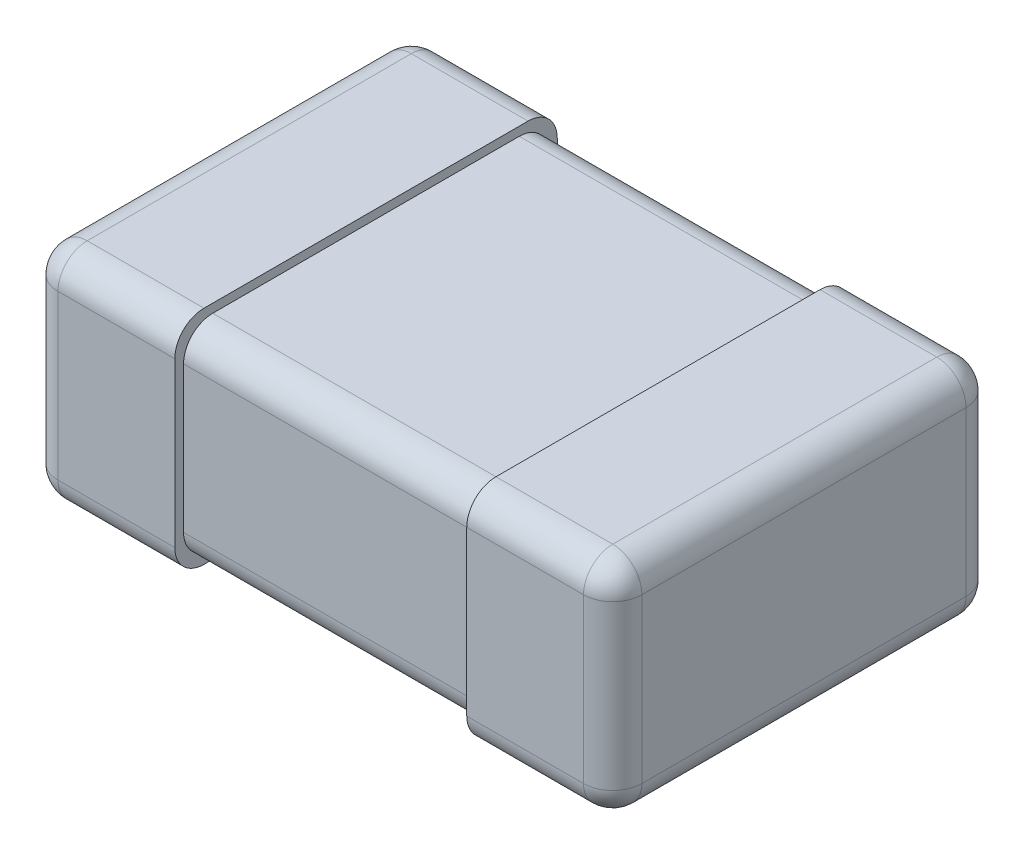
from build123d import *

# Parameters (mm, degrees)
SKETCH1_W           = 2
SKETCH1_H           = 1.25
EXTRUDE1_DEPTH      = 0.7
EXTRUDE2_DEPTH      = 0.655
EXTRUDE2_DEPTH_BACK = 0.655
SKETCH2_W           = 0.5
SKETCH2_H           = 0.76
FILLET1_R           = 0.1


with BuildPart() as part:
    # Sketch1 → Extrude1 (new body)
    with BuildSketch(Plane(origin=(0, 0, 0), x_dir=(1, 0, 0), z_dir=(0, 1, 0))):
        Rectangle(SKETCH1_W, SKETCH1_H)
    extrude(amount=EXTRUDE1_DEPTH)

    # Sketch2 → Extrude2 (add, two sides: drawn at the far end of the back side and taken through both)
    with BuildSketch(Plane.XY.offset(-EXTRUDE2_DEPTH_BACK)):
        with Locations((-0.75, 0.35)):
            Rectangle(SKETCH2_W, SKETCH2_H)
        with Locations((0.75, 0.35)):
            Rectangle(SKETCH2_W, SKETCH2_H)
    extrude(amount=EXTRUDE2_DEPTH + EXTRUDE2_DEPTH_BACK)

    # Fillet1
    fillet1_edges = [part.edges().sort_by_distance(p)[0] for p in [
        (0, 0, 0.625),
        (0, 0.7, 0.625),
        (-0.75, -0.03, 0.655),
        (-1, -0.03, 0),
        (-1, 0.35, 0.655),
        (-1, 0.73, 0),
        (-0.75, 0.73, 0.655),
        (-0.75, -0.03, -0.655),
        (-1, 0.35, -0.655),
        (-0.75, 0.73, -0.655),
        (0, 0, -0.625),
        (0, 0.7, -0.625),
        (1, 0.35, 0.655),
        (1, -0.03, 0),
        (0.75, -0.03, 0.655),
        (0.75, 0.73, 0.655),
        (1, 0.73, 0),
        (0.75, 0.73, -0.655),
        (1, 0.35, -0.655),
        (0.75, -0.03, -0.655),
    ]]
    fillet(fillet1_edges, radius=FILLET1_R)


solid = part.part
